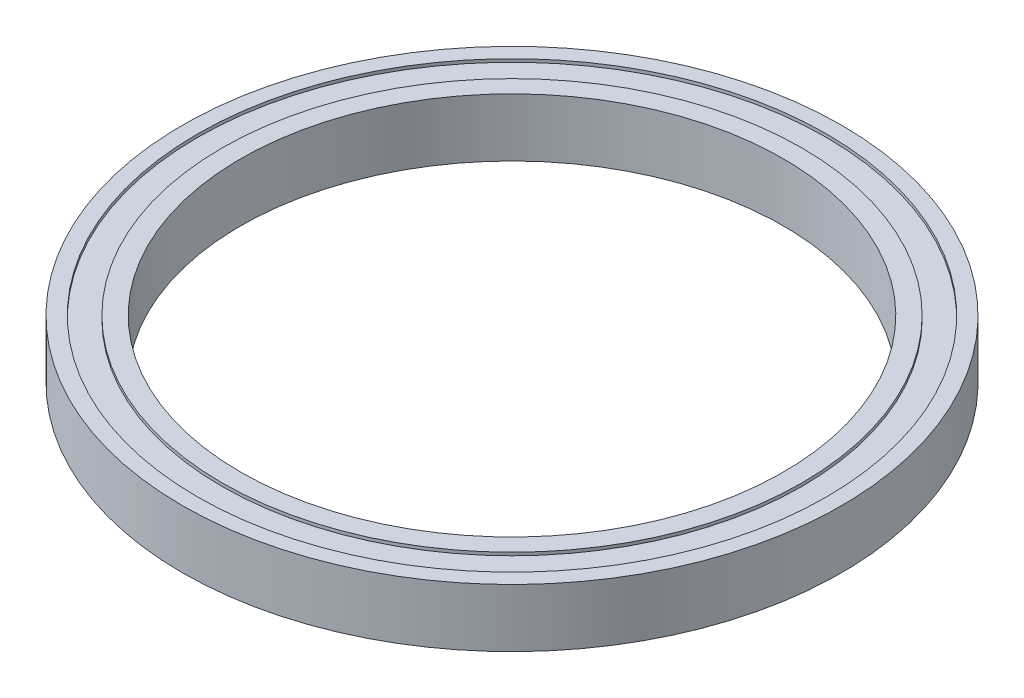
from build123d import *

# Parameters (mm, degrees)
EXTRUDE_1_DEPTH      = 2.3815
EXTRUDE_1_DEPTH_BACK = 2.3815
SKETCH_1_R           = 26.9875
SKETCH_1_R_2         = 22.225
SKETCH_2_R           = 25.75
SKETCH_2_R_2         = 23.75
CUT_EXTRUDE_1_DEPTH  = 0.254


with BuildPart() as part:
    # ｽｹｯﾁ1 → ﾎﾞｽ - 押し出し1 (new, two sides: drawn at the far end of the back side and taken through both)
    with BuildSketch(Plane(origin=(0, 0, 0), x_dir=(1, 0, 0), z_dir=(0, 1, 0)).offset(-EXTRUDE_1_DEPTH_BACK)):
        Circle(SKETCH_1_R)
        Circle(SKETCH_1_R_2, mode=Mode.SUBTRACT)
    extrude(amount=EXTRUDE_1_DEPTH + EXTRUDE_1_DEPTH_BACK)

    # ｽｹｯﾁ2 → ｶｯﾄ - 押し出し1 (cut)
    with BuildSketch(Plane(origin=(0, 2.3815, 0), x_dir=(1, 0, 0), z_dir=(0, 1, 0))):
        Circle(SKETCH_2_R)
        Circle(SKETCH_2_R_2, mode=Mode.SUBTRACT)
    cut_extrude_1 = extrude(amount=-CUT_EXTRUDE_1_DEPTH, mode=Mode.SUBTRACT)

    # ﾐﾗｰ1: ｶｯﾄ - 押し出し1 across plane
    add(cut_extrude_1.mirror(Plane.ZX), mode=Mode.SUBTRACT)


solid = part.part
